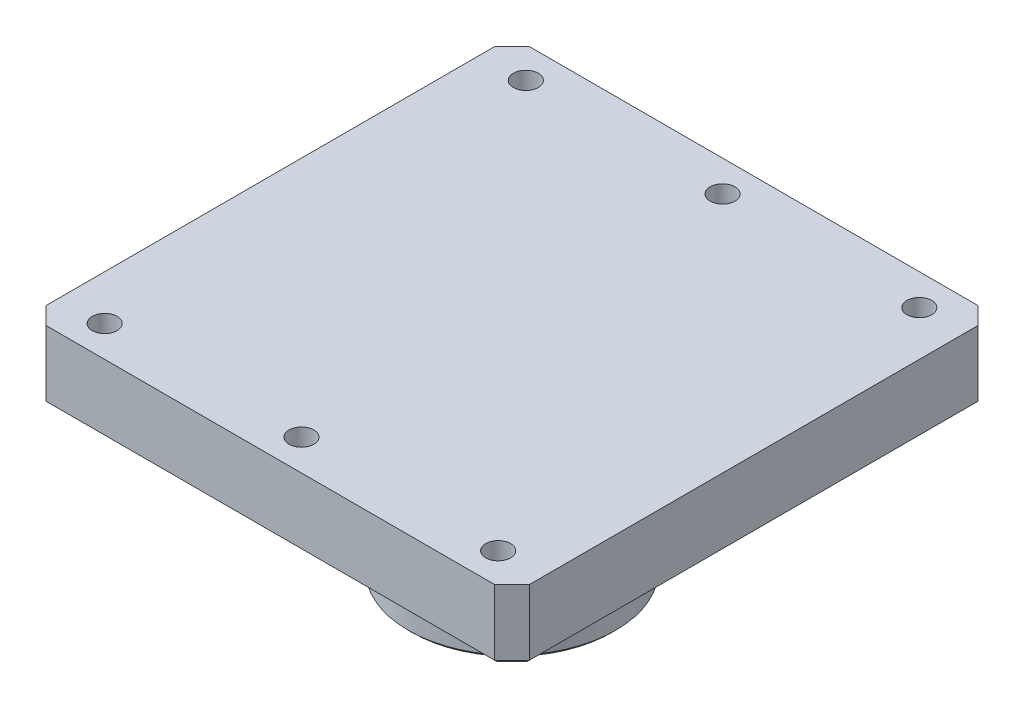
from build123d import *

# Parameters (mm, degrees)
SKETCH1_W                                           = 70
SKETCH1_H                                           = 70
BOSS_EXTRUDE1_DEPTH                                 = 10
SKETCH1_3_R                                         = 15
BOSS_EXTRUDE2_DEPTH                                 = 22.5
CUT_EXTRUDE1_START                                  = -1
SKETCH2_R                                           = 25.85
SKETCH2_R_2                                         = 15
CUT_EXTRUDE1_DEPTH                                  = 1
CBORE_FOR_M3_HEX_SOCKET_HEAD_CAP_SCREW1_D           = 3.6
CBORE_FOR_M3_HEX_SOCKET_HEAD_CAP_SCREW1_CBORE_D     = 6.5
CBORE_FOR_M3_HEX_SOCKET_HEAD_CAP_SCREW1_CBORE_DEPTH = 4.4
F_2_5MM_CHAMFER1_SIZE                               = 2.5
F_0_5MM_CHAMFER2_SIZE                               = 0.5


with BuildPart() as part:
    # Sketch1 → Boss-Extrude1 (new body)
    with BuildSketch(Plane(origin=(0, 0, 0), x_dir=(1, 0, 0), z_dir=(0, 1, 0))):
        Rectangle(SKETCH1_W, SKETCH1_H)
    extrude(amount=BOSS_EXTRUDE1_DEPTH)

    # Sketch1<3> → Boss-Extrude2 (add)
    with BuildSketch(Plane(origin=(0, 0, 0), x_dir=(1, 0, 0), z_dir=(0, 1, 0))):
        with Locations(Location((0, 0, 0), (0, 0, 270))):
            Circle(SKETCH1_3_R)
        with BuildLine():
            Line((-1.5, 2), (1.5, 2))
            ThreePointArc((1.5, 2), (0, -2.5), (-1.5, 2))
        make_face(mode=Mode.SUBTRACT)
    extrude(amount=-BOSS_EXTRUDE2_DEPTH)

    # Sketch2 → Cut-Extrude1 (cut)
    with BuildSketch(Plane.XZ.offset(CUT_EXTRUDE1_START)):
        with Locations(Location((0, 0, 0), (0, 0, 270))):
            Circle(SKETCH2_R)
        with Locations(Location((0, 0, 0), (0, 0, 90))):
            Circle(SKETCH2_R_2, mode=Mode.SUBTRACT)
    extrude(amount=CUT_EXTRUDE1_DEPTH, mode=Mode.SUBTRACT)

    # CBORE for M3 Hex Socket Head Cap Screw1 (through all)
    with Locations(Plane(origin=(0, 0, 0), x_dir=(-1, 0, 0), z_dir=(0, -1, 0))):
        with Locations((-28.5, 30.5), (28.5, -30.5), (-28.5, -30.5), (28.5, 30.5), (0, -30.5), (0, 30.5)):
            CounterBoreHole(CBORE_FOR_M3_HEX_SOCKET_HEAD_CAP_SCREW1_D / 2, CBORE_FOR_M3_HEX_SOCKET_HEAD_CAP_SCREW1_CBORE_D / 2, CBORE_FOR_M3_HEX_SOCKET_HEAD_CAP_SCREW1_CBORE_DEPTH)

    # 2,5mm Chamfer1
    f_2_5mm_chamfer1_edges = [part.edges().sort_by_distance(p)[0] for p in [
        (-35, 5, -35),
        (-35, 5, 35),
        (35, 5, 35),
        (35, 5, -35),
    ]]
    chamfer(f_2_5mm_chamfer1_edges, length=F_2_5MM_CHAMFER1_SIZE)

    # 0,5mm Chamfer2
    f_0_5mm_chamfer2_edges = [part.edges().sort_by_distance(p)[0] for p in [
        (0, -22.5, -2),
        (0, -22.5, -15),
        (0, -22.5, 2.5),
        (0, 0, 25.85),
        (3.25, 0, -30.5),
        (3.25, 0, 30.5),
        (-25.25, 0, -30.5),
        (31.75, 0, 30.5),
        (-25.25, 0, 30.5),
        (31.75, 0, -30.5),
        (0, 0, 35),
        (0, 0, -35),
        (35, 0, 0),
        (-35, 0, 0),
        (33.75, 0, -33.75),
        (-33.75, 0, -33.75),
        (33.75, 0, 33.75),
        (-33.75, 0, 33.75),
    ]]
    chamfer(f_0_5mm_chamfer2_edges, length=F_0_5MM_CHAMFER2_SIZE)


solid = part.part
